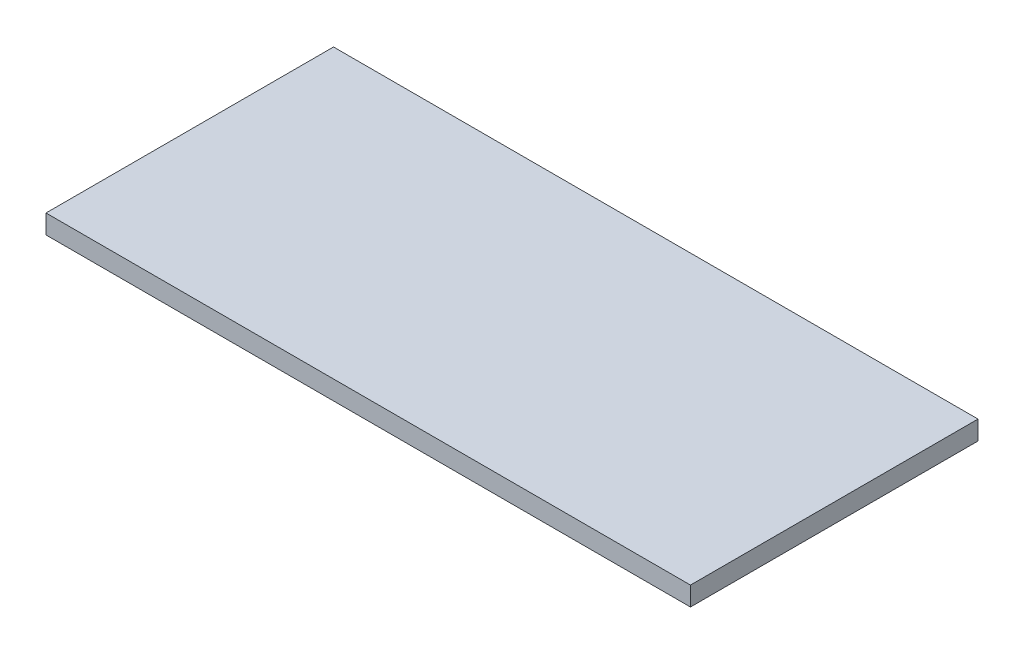
from build123d import *

# Parameters (mm, degrees)
SKETCH1_W           = 51.59375
SKETCH1_H           = 23.01875
BOSS_EXTRUDE1_DEPTH = 1.524


with BuildPart() as part:
    # Sketch1 → Boss-Extrude1 (new body)
    with BuildSketch(Plane(origin=(0, 0, 0), x_dir=(1, 0, 0), z_dir=(0, 1, 0))):
        Rectangle(SKETCH1_W, SKETCH1_H)
    extrude(amount=BOSS_EXTRUDE1_DEPTH)


solid = part.part
